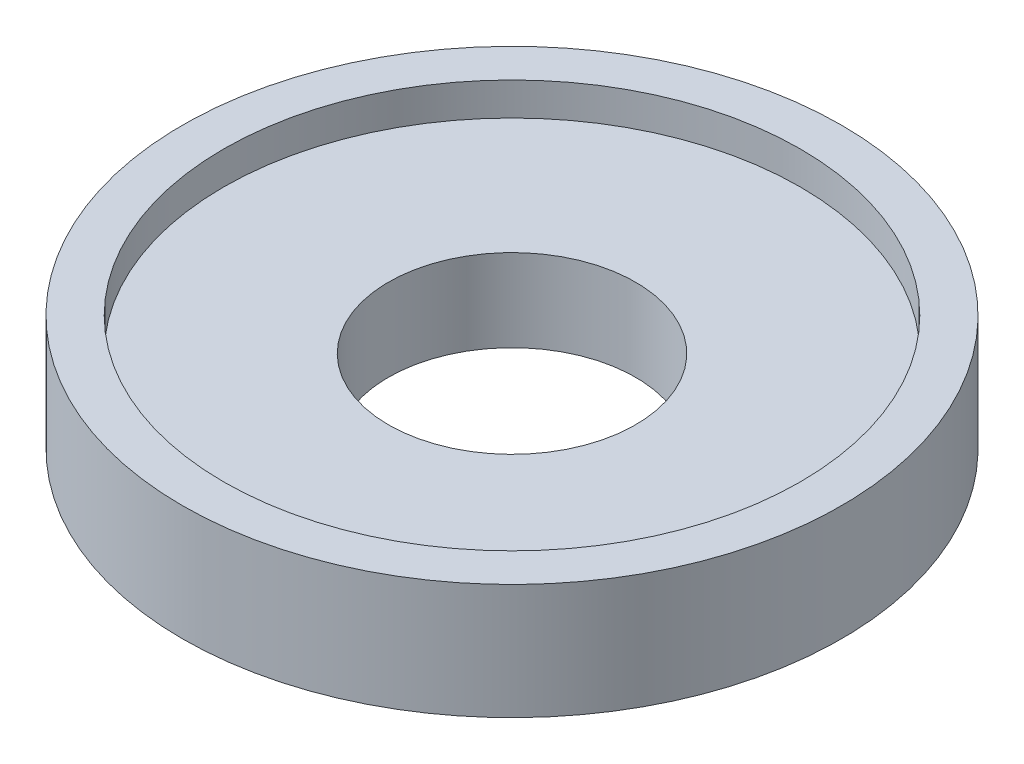
from build123d import *

# Parameters (mm, degrees)
SKETCH1_R           = 20
SKETCH1_R_2         = 17.5
BOSS_EXTRUDE1_DEPTH = 5
SKETCH1_3_R         = 20
SKETCH1_3_R_2       = 17.5
BOSS_EXTRUDE3_DEPTH = 7
SKETCH3_R           = 7.5
CUT_EXTRUDE2_DEPTH  = 7


with BuildPart() as part:
    # Sketch1 → Boss-Extrude1 (new body)
    # profile 1 of 2: a face of its own
    with BuildSketch(Plane(origin=(0, 0, 0), x_dir=(1, 0, 0), z_dir=(0, 1, 0))):
        Circle(SKETCH1_R)
        Circle(SKETCH1_R_2, mode=Mode.SUBTRACT)
    # profile 2 of 2: a face of its own
    with BuildSketch(Plane(origin=(0, 0, 0), x_dir=(1, 0, 0), z_dir=(0, 1, 0))):
        Circle(SKETCH1_R_2)
    extrude(amount=BOSS_EXTRUDE1_DEPTH)

    # Sketch1<3> → Boss-Extrude3 (add)
    with BuildSketch(Plane(origin=(0, 0, 0), x_dir=(1, 0, 0), z_dir=(0, 1, 0))):
        Circle(SKETCH1_3_R)
        Circle(SKETCH1_3_R_2, mode=Mode.SUBTRACT)
    extrude(amount=BOSS_EXTRUDE3_DEPTH)

    # Sketch3 → Cut-Extrude2 (cut)
    with BuildSketch(Plane(origin=(0, 5, 0), x_dir=(1, 0, 0), z_dir=(0, 1, 0))):
        Circle(SKETCH3_R)
    extrude(amount=-CUT_EXTRUDE2_DEPTH, mode=Mode.SUBTRACT)


solid = part.part
